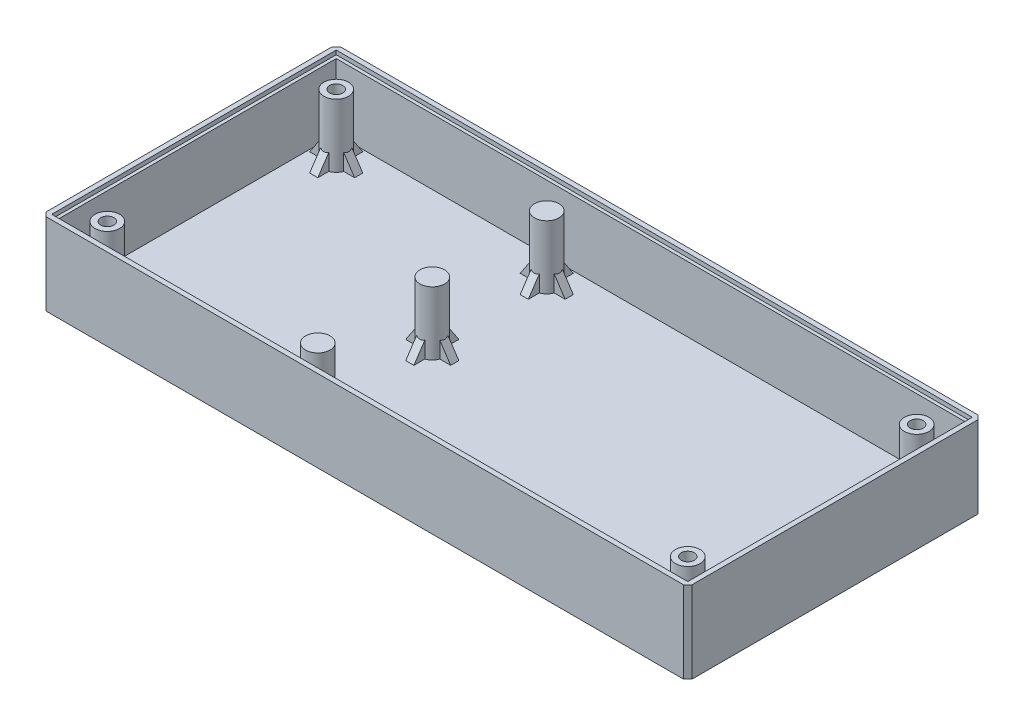
from build123d import *

# Parameters (mm, degrees)
SKETCH1_W                  = 154
SKETCH1_H                  = 68
SKETCH1_R                  = 1.6
BOSS_EXTRUDE1_DEPTH        = 3
SKETCH1_4_W                = 158
SKETCH1_4_H                = 72
SKETCH1_4_W_2              = 154
SKETCH1_4_H_2              = 68
BOSS_EXTRUDE2_DEPTH        = 19
SKETCH2_W                  = 158
SKETCH2_H                  = 72
SKETCH2_W_2                = 155.6
SKETCH2_H_2                = 69.6
BOSS_EXTRUDE3_DEPTH        = 1
SKETCH1_5_R                = 3
SKETCH1_5_R_2              = 1.6
BOSS_EXTRUDE4_DEPTH        = 18.5
BOSS_EXTRUDE5_DEPTH        = 2
SKETCH3_R                  = 1.6
CUT_EXTRUDE1_DEPTH         = 2
LPATTERN1_COUNT            = 2
LPATTERN1_PITCH            = 142
LPATTERN1_COUNT_DIR2       = 2
LPATTERN1_PITCH_DIR2       = 56
CHAMFER1_SIZE              = 1
RIB1_REACH                 = 105.619
SKETCH6_WALL_W             = 216.45009502
SKETCH6_WALL_H             = 2
CIRPATTERN3_COUNT          = 4
LPATTERN2_COPY_1_REACH     = 105.619
LPATTERN2_COPY_1_SKETCH_W  = 216.45009502
LPATTERN2_COPY_1_SKETCH_H  = 2
LPATTERN2_COPY_2_REACH     = 105.619
LPATTERN2_COPY_2_SKETCH_W  = 216.45009502
LPATTERN2_COPY_2_SKETCH_H  = 2
LPATTERN2_COPY_3_REACH     = 105.619
LPATTERN2_COPY_3_SKETCH_W  = 216.45009502
LPATTERN2_COPY_3_SKETCH_H  = 2
LPATTERN2_COPY_4_REACH     = 105.619
LPATTERN2_COPY_4_SKETCH_W  = 216.45009502
LPATTERN2_COPY_4_SKETCH_H  = 2
LPATTERN2_COPY_5_REACH     = 105.619
LPATTERN2_COPY_5_SKETCH_W  = 216.45009502
LPATTERN2_COPY_5_SKETCH_H  = 2
LPATTERN2_COPY_6_REACH     = 105.619
LPATTERN2_COPY_6_SKETCH_W  = 216.45009502
LPATTERN2_COPY_6_SKETCH_H  = 2
LPATTERN2_COPY_7_REACH     = 105.619
LPATTERN2_COPY_7_SKETCH_W  = 216.45009502
LPATTERN2_COPY_7_SKETCH_H  = 2
LPATTERN2_COPY_8_REACH     = 105.619
LPATTERN2_COPY_8_SKETCH_W  = 216.45009502
LPATTERN2_COPY_8_SKETCH_H  = 2
LPATTERN2_COPY_9_REACH     = 105.619
LPATTERN2_COPY_9_SKETCH_W  = 216.45009502
LPATTERN2_COPY_9_SKETCH_H  = 2
LPATTERN2_COPY_10_REACH    = 105.619
LPATTERN2_COPY_10_SKETCH_W = 216.45009502
LPATTERN2_COPY_10_SKETCH_H = 2
LPATTERN2_COPY_11_REACH    = 105.619
LPATTERN2_COPY_11_SKETCH_W = 216.45009502
LPATTERN2_COPY_11_SKETCH_H = 2
LPATTERN2_COPY_12_REACH    = 105.619
LPATTERN2_COPY_12_SKETCH_W = 216.45009502
LPATTERN2_COPY_12_SKETCH_H = 2
RIB2_REACH                 = 105.619
SKETCH7_WALL_W             = 216.45009502
SKETCH7_WALL_H             = 2
CIRPATTERN4_COUNT          = 4
LPATTERN8_COPY_1_REACH     = 105.619
LPATTERN8_COPY_1_SKETCH_W  = 216.45009502
LPATTERN8_COPY_1_SKETCH_H  = 2
LPATTERN8_COPY_2_REACH     = 105.619
LPATTERN8_COPY_2_SKETCH_W  = 216.45009502
LPATTERN8_COPY_2_SKETCH_H  = 2
LPATTERN8_COPY_3_REACH     = 105.619
LPATTERN8_COPY_3_SKETCH_W  = 216.45009502
LPATTERN8_COPY_3_SKETCH_H  = 2
LPATTERN8_COPY_4_REACH     = 105.619
LPATTERN8_COPY_4_SKETCH_W  = 216.45009502
LPATTERN8_COPY_4_SKETCH_H  = 2
LPATTERN8_COPY_5_REACH     = 105.619
LPATTERN8_COPY_5_SKETCH_W  = 216.45009502
LPATTERN8_COPY_5_SKETCH_H  = 2
LPATTERN8_COPY_6_REACH     = 105.619
LPATTERN8_COPY_6_SKETCH_W  = 216.45009502
LPATTERN8_COPY_6_SKETCH_H  = 2
LPATTERN8_COPY_7_REACH     = 105.619
LPATTERN8_COPY_7_SKETCH_W  = 216.45009502
LPATTERN8_COPY_7_SKETCH_H  = 2
LPATTERN8_COPY_8_REACH     = 105.619
LPATTERN8_COPY_8_SKETCH_W  = 216.45009502
LPATTERN8_COPY_8_SKETCH_H  = 2


with BuildPart() as part:
    # Sketch1 → Boss-Extrude1 (new body)
    with BuildSketch(Plane(origin=(0, 0, 0), x_dir=(1, 0, 0), z_dir=(0, 1, 0))):
        Rectangle(SKETCH1_W, SKETCH1_H)
        with Locations((-71, -28)):
            Circle(SKETCH1_R, mode=Mode.SUBTRACT)
        with Locations((71, -28)):
            Circle(SKETCH1_R, mode=Mode.SUBTRACT)
        with Locations((-71, 28)):
            Circle(SKETCH1_R, mode=Mode.SUBTRACT)
        with Locations((71, 28)):
            Circle(SKETCH1_R, mode=Mode.SUBTRACT)
    extrude(amount=BOSS_EXTRUDE1_DEPTH)

    # Sketch1<4> → Boss-Extrude2 (add)
    with BuildSketch(Plane(origin=(0, 0, 0), x_dir=(1, 0, 0), z_dir=(0, 1, 0))):
        Rectangle(SKETCH1_4_W, SKETCH1_4_H)
        Rectangle(SKETCH1_4_W_2, SKETCH1_4_H_2, mode=Mode.SUBTRACT)
    extrude(amount=BOSS_EXTRUDE2_DEPTH)

    # Sketch2 → Boss-Extrude3 (add)
    with BuildSketch(Plane(origin=(0, 19, 0), x_dir=(1, 0, 0), z_dir=(0, 1, 0))):
        Rectangle(SKETCH2_W, SKETCH2_H)
        Rectangle(SKETCH2_W_2, SKETCH2_H_2, mode=Mode.SUBTRACT)
    extrude(amount=BOSS_EXTRUDE3_DEPTH)

    # Sketch1<5> → Boss-Extrude4 (add)
    # profile 1 of 7: a face of its own
    with BuildSketch(Plane(origin=(0, 0, 0), x_dir=(1, 0, 0), z_dir=(0, 1, 0))):
        with Locations((-71, 28)):
            Circle(SKETCH1_5_R)
        with Locations((-71, 28)):
            Circle(SKETCH1_5_R_2, mode=Mode.SUBTRACT)
    # profile 2 of 7: a face of its own
    with BuildSketch(Plane(origin=(0, 0, 0), x_dir=(1, 0, 0), z_dir=(0, 1, 0))):
        with Locations((71, 28)):
            Circle(SKETCH1_5_R)
        with Locations((71, 28)):
            Circle(SKETCH1_5_R_2, mode=Mode.SUBTRACT)
    # profile 3 of 7: a face of its own
    with BuildSketch(Plane(origin=(0, 0, 0), x_dir=(1, 0, 0), z_dir=(0, 1, 0))):
        with Locations((71, -28)):
            Circle(SKETCH1_5_R)
        with Locations((71, -28)):
            Circle(SKETCH1_5_R_2, mode=Mode.SUBTRACT)
    # profile 4 of 7: a face of its own
    with BuildSketch(Plane(origin=(0, 0, 0), x_dir=(1, 0, 0), z_dir=(0, 1, 0))):
        with Locations((-71, -28)):
            Circle(SKETCH1_5_R)
        with Locations((-71, -28)):
            Circle(SKETCH1_5_R_2, mode=Mode.SUBTRACT)
    # profile 5 of 7: a face of its own
    with BuildSketch(Plane(origin=(0, 0, 0), x_dir=(1, 0, 0), z_dir=(0, 1, 0))):
        with Locations((-19.5, 28)):
            Circle(SKETCH1_5_R)
    # profile 6 of 7: a face of its own
    with BuildSketch(Plane(origin=(0, 0, 0), x_dir=(1, 0, 0), z_dir=(0, 1, 0))):
        with Locations((-19.5, -28)):
            Circle(SKETCH1_5_R)
    # profile 7 of 7: a face of its own
    with BuildSketch(Plane(origin=(0, 0, 0), x_dir=(1, 0, 0), z_dir=(0, 1, 0))):
        with Locations((-19.5, 0)):
            Circle(SKETCH1_5_R)
    extrude(amount=BOSS_EXTRUDE4_DEPTH)

    # Sketch3<3> → Boss-Extrude5 (add)
    with BuildSketch(Plane.XZ):
        Polygon((-68.834936491, 24.25), (-66.669872981, 28), (-68.834936491, 31.75), (-73.165063509, 31.75), (-75.330127019, 28), (-73.165063509, 24.25), align=None)
        Polygon((-69.41228676, 25.25), (-67.824573519, 28), (-69.41228676, 30.75), (-72.58771324, 30.75), (-74.175426481, 28), (-72.58771324, 25.25), align=None, mode=Mode.SUBTRACT)
    boss_extrude5 = extrude(amount=-BOSS_EXTRUDE5_DEPTH)

    # Sketch3 → Cut-Extrude1 (cut)
    with BuildSketch(Plane.XZ):
        Polygon((-72.58771324, 25.25), (-69.41228676, 25.25), (-67.824573519, 28), (-69.41228676, 30.75), (-72.58771324, 30.75), (-74.175426481, 28), align=None)
        with Locations((-71, 28)):
            Circle(SKETCH3_R, mode=Mode.SUBTRACT)
    cut_extrude1 = extrude(amount=-CUT_EXTRUDE1_DEPTH, mode=Mode.SUBTRACT)

    # LPattern1: Boss-Extrude5, Cut-Extrude1 2 × 2
    with Locations(*[(i * LPATTERN1_PITCH, 0, -j * LPATTERN1_PITCH_DIR2) for i in range(LPATTERN1_COUNT) for j in range(LPATTERN1_COUNT_DIR2) if (i, j) != (0, 0)]):
        add(boss_extrude5)
        add(cut_extrude1, mode=Mode.SUBTRACT)

    # Chamfer1
    chamfer1_edges = [part.edges().sort_by_distance(p)[0] for p in [
        (-79, 10, 36),
        (-79, 10, -36),
        (79, 10, 36),
        (79, 10, -36),
    ]]
    chamfer(chamfer1_edges, length=CHAMFER1_SIZE)

    # Sketch6 wall → Rib1 (add, up to next)
    with BuildSketch(Plane(origin=(67.5, 6, -28), x_dir=(0.554700196225, 0.832050294338, 0), z_dir=(-0.832050294338, 0.554700196225, 0)), mode=Mode.PRIVATE) as rib1_sk1:
        Rectangle(SKETCH6_WALL_W, SKETCH6_WALL_H)
    rib1_tool1 = extrude(rib1_sk1.sketch, amount=-RIB1_REACH, mode=Mode.PRIVATE) - part.part
    rib1 = rib1_tool1.solids().sort_by_distance((67.5, 6, -28))[0]
    add(rib1)

    # CirPattern3: Rib1 ×4 about axis
    cirpattern3_axis = Axis((71, 3, -28), (0, 1, 0))
    for i in range(1, CIRPATTERN3_COUNT):
        add(rib1.rotate(cirpattern3_axis, i * 360 / CIRPATTERN3_COUNT))

    # LPattern2 copy 1 sketch → LPattern2 copy 1 (add, up to next)
    with BuildSketch(Plane(origin=(71, 6, 31.5), x_dir=(0, 0.832050294338, -0.554700196225), z_dir=(0, 0.554700196225, 0.832050294338)), mode=Mode.PRIVATE) as lpattern2_copy_1_sk1:
        Rectangle(LPATTERN2_COPY_1_SKETCH_W, LPATTERN2_COPY_1_SKETCH_H)
    lpattern2_copy_1_tool1 = extrude(lpattern2_copy_1_sk1.sketch, amount=-LPATTERN2_COPY_1_REACH, mode=Mode.PRIVATE) - part.part
    add(lpattern2_copy_1_tool1.solids().sort_by_distance((71, 6, 31.5))[0])

    # LPattern2 copy 2 sketch → LPattern2 copy 2 (add, up to next)
    with BuildSketch(Plane(origin=(-71, 6, -24.5), x_dir=(0, 0.832050294338, -0.554700196225), z_dir=(0, 0.554700196225, 0.832050294338)), mode=Mode.PRIVATE) as lpattern2_copy_2_sk1:
        Rectangle(LPATTERN2_COPY_2_SKETCH_W, LPATTERN2_COPY_2_SKETCH_H)
    lpattern2_copy_2_tool1 = extrude(lpattern2_copy_2_sk1.sketch, amount=-LPATTERN2_COPY_2_REACH, mode=Mode.PRIVATE) - part.part
    add(lpattern2_copy_2_tool1.solids().sort_by_distance((-71, 6, -24.5))[0])

    # LPattern2 copy 3 sketch → LPattern2 copy 3 (add, up to next)
    with BuildSketch(Plane(origin=(-71, 6, 31.5), x_dir=(0, 0.832050294338, -0.554700196225), z_dir=(0, 0.554700196225, 0.832050294338)), mode=Mode.PRIVATE) as lpattern2_copy_3_sk1:
        Rectangle(LPATTERN2_COPY_3_SKETCH_W, LPATTERN2_COPY_3_SKETCH_H)
    lpattern2_copy_3_tool1 = extrude(lpattern2_copy_3_sk1.sketch, amount=-LPATTERN2_COPY_3_REACH, mode=Mode.PRIVATE) - part.part
    add(lpattern2_copy_3_tool1.solids().sort_by_distance((-71, 6, 31.5))[0])

    # LPattern2 copy 4 sketch → LPattern2 copy 4 (add, up to next)
    with BuildSketch(Plane(origin=(74.5, 6, 28), x_dir=(-0.554700196225, 0.832050294338, 0), z_dir=(0.832050294338, 0.554700196225, 0)), mode=Mode.PRIVATE) as lpattern2_copy_4_sk1:
        Rectangle(LPATTERN2_COPY_4_SKETCH_W, LPATTERN2_COPY_4_SKETCH_H)
    lpattern2_copy_4_tool1 = extrude(lpattern2_copy_4_sk1.sketch, amount=-LPATTERN2_COPY_4_REACH, mode=Mode.PRIVATE) - part.part
    add(lpattern2_copy_4_tool1.solids().sort_by_distance((74.5, 6, 28))[0])

    # LPattern2 copy 5 sketch → LPattern2 copy 5 (add, up to next)
    with BuildSketch(Plane(origin=(-67.5, 6, -28), x_dir=(-0.554700196225, 0.832050294338, 0), z_dir=(0.832050294338, 0.554700196225, 0)), mode=Mode.PRIVATE) as lpattern2_copy_5_sk1:
        Rectangle(LPATTERN2_COPY_5_SKETCH_W, LPATTERN2_COPY_5_SKETCH_H)
    lpattern2_copy_5_tool1 = extrude(lpattern2_copy_5_sk1.sketch, amount=-LPATTERN2_COPY_5_REACH, mode=Mode.PRIVATE) - part.part
    add(lpattern2_copy_5_tool1.solids().sort_by_distance((-67.5, 6, -28))[0])

    # LPattern2 copy 6 sketch → LPattern2 copy 6 (add, up to next)
    with BuildSketch(Plane(origin=(-67.5, 6, 28), x_dir=(-0.554700196225, 0.832050294338, 0), z_dir=(0.832050294338, 0.554700196225, 0)), mode=Mode.PRIVATE) as lpattern2_copy_6_sk1:
        Rectangle(LPATTERN2_COPY_6_SKETCH_W, LPATTERN2_COPY_6_SKETCH_H)
    lpattern2_copy_6_tool1 = extrude(lpattern2_copy_6_sk1.sketch, amount=-LPATTERN2_COPY_6_REACH, mode=Mode.PRIVATE) - part.part
    add(lpattern2_copy_6_tool1.solids().sort_by_distance((-67.5, 6, 28))[0])

    # LPattern2 copy 7 sketch → LPattern2 copy 7 (add, up to next)
    with BuildSketch(Plane(origin=(71, 6, 24.5), x_dir=(0, 0.832050294338, 0.554700196225), z_dir=(0, 0.554700196225, -0.832050294338)), mode=Mode.PRIVATE) as lpattern2_copy_7_sk1:
        Rectangle(LPATTERN2_COPY_7_SKETCH_W, LPATTERN2_COPY_7_SKETCH_H)
    lpattern2_copy_7_tool1 = extrude(lpattern2_copy_7_sk1.sketch, amount=-LPATTERN2_COPY_7_REACH, mode=Mode.PRIVATE) - part.part
    add(lpattern2_copy_7_tool1.solids().sort_by_distance((71, 6, 24.5))[0])

    # LPattern2 copy 8 sketch → LPattern2 copy 8 (add, up to next)
    with BuildSketch(Plane(origin=(-71, 6, -31.5), x_dir=(0, 0.832050294338, 0.554700196225), z_dir=(0, 0.554700196225, -0.832050294338)), mode=Mode.PRIVATE) as lpattern2_copy_8_sk1:
        Rectangle(LPATTERN2_COPY_8_SKETCH_W, LPATTERN2_COPY_8_SKETCH_H)
    lpattern2_copy_8_tool1 = extrude(lpattern2_copy_8_sk1.sketch, amount=-LPATTERN2_COPY_8_REACH, mode=Mode.PRIVATE) - part.part
    add(lpattern2_copy_8_tool1.solids().sort_by_distance((-71, 6, -31.5))[0])

    # LPattern2 copy 9 sketch → LPattern2 copy 9 (add, up to next)
    with BuildSketch(Plane(origin=(-71, 6, 24.5), x_dir=(0, 0.832050294338, 0.554700196225), z_dir=(0, 0.554700196225, -0.832050294338)), mode=Mode.PRIVATE) as lpattern2_copy_9_sk1:
        Rectangle(LPATTERN2_COPY_9_SKETCH_W, LPATTERN2_COPY_9_SKETCH_H)
    lpattern2_copy_9_tool1 = extrude(lpattern2_copy_9_sk1.sketch, amount=-LPATTERN2_COPY_9_REACH, mode=Mode.PRIVATE) - part.part
    add(lpattern2_copy_9_tool1.solids().sort_by_distance((-71, 6, 24.5))[0])

    # LPattern2 copy 10 sketch → LPattern2 copy 10 (add, up to next)
    with BuildSketch(Plane(origin=(67.5, 6, 28), x_dir=(0.554700196225, 0.832050294338, 0), z_dir=(-0.832050294338, 0.554700196225, 0)), mode=Mode.PRIVATE) as lpattern2_copy_10_sk1:
        Rectangle(LPATTERN2_COPY_10_SKETCH_W, LPATTERN2_COPY_10_SKETCH_H)
    lpattern2_copy_10_tool1 = extrude(lpattern2_copy_10_sk1.sketch, amount=-LPATTERN2_COPY_10_REACH, mode=Mode.PRIVATE) - part.part
    add(lpattern2_copy_10_tool1.solids().sort_by_distance((67.5, 6, 28))[0])

    # LPattern2 copy 11 sketch → LPattern2 copy 11 (add, up to next)
    with BuildSketch(Plane(origin=(-74.5, 6, -28), x_dir=(0.554700196225, 0.832050294338, 0), z_dir=(-0.832050294338, 0.554700196225, 0)), mode=Mode.PRIVATE) as lpattern2_copy_11_sk1:
        Rectangle(LPATTERN2_COPY_11_SKETCH_W, LPATTERN2_COPY_11_SKETCH_H)
    lpattern2_copy_11_tool1 = extrude(lpattern2_copy_11_sk1.sketch, amount=-LPATTERN2_COPY_11_REACH, mode=Mode.PRIVATE) - part.part
    add(lpattern2_copy_11_tool1.solids().sort_by_distance((-74.5, 6, -28))[0])

    # LPattern2 copy 12 sketch → LPattern2 copy 12 (add, up to next)
    with BuildSketch(Plane(origin=(-74.5, 6, 28), x_dir=(0.554700196225, 0.832050294338, 0), z_dir=(-0.832050294338, 0.554700196225, 0)), mode=Mode.PRIVATE) as lpattern2_copy_12_sk1:
        Rectangle(LPATTERN2_COPY_12_SKETCH_W, LPATTERN2_COPY_12_SKETCH_H)
    lpattern2_copy_12_tool1 = extrude(lpattern2_copy_12_sk1.sketch, amount=-LPATTERN2_COPY_12_REACH, mode=Mode.PRIVATE) - part.part
    add(lpattern2_copy_12_tool1.solids().sort_by_distance((-74.5, 6, 28))[0])

    # Sketch7 wall → Rib2 (add, up to next)
    with BuildSketch(Plane(origin=(-23, 6, -28), x_dir=(0.554700196225, 0.832050294338, 0), z_dir=(-0.832050294338, 0.554700196225, 0)), mode=Mode.PRIVATE) as rib2_sk1:
        Rectangle(SKETCH7_WALL_W, SKETCH7_WALL_H)
    rib2_tool1 = extrude(rib2_sk1.sketch, amount=-RIB2_REACH, mode=Mode.PRIVATE) - part.part
    rib2 = rib2_tool1.solids().sort_by_distance((-23, 6, -28))[0]
    add(rib2)

    # CirPattern4: Rib2 ×4 about axis
    cirpattern4_axis = Axis((-19.5, 18.5, -28), (0, 1, 0))
    for i in range(1, CIRPATTERN4_COUNT):
        add(rib2.rotate(cirpattern4_axis, i * 360 / CIRPATTERN4_COUNT))

    # LPattern8 copy 1 sketch → LPattern8 copy 1 (add, up to next)
    with BuildSketch(Plane(origin=(-19.5, 6, 3.5), x_dir=(0, 0.832050294338, -0.554700196225), z_dir=(0, 0.554700196225, 0.832050294338)), mode=Mode.PRIVATE) as lpattern8_copy_1_sk1:
        Rectangle(LPATTERN8_COPY_1_SKETCH_W, LPATTERN8_COPY_1_SKETCH_H)
    lpattern8_copy_1_tool1 = extrude(lpattern8_copy_1_sk1.sketch, amount=-LPATTERN8_COPY_1_REACH, mode=Mode.PRIVATE) - part.part
    add(lpattern8_copy_1_tool1.solids().sort_by_distance((-19.5, 6, 3.5))[0])

    # LPattern8 copy 2 sketch → LPattern8 copy 2 (add, up to next)
    with BuildSketch(Plane(origin=(-19.5, 6, 31.5), x_dir=(0, 0.832050294338, -0.554700196225), z_dir=(0, 0.554700196225, 0.832050294338)), mode=Mode.PRIVATE) as lpattern8_copy_2_sk1:
        Rectangle(LPATTERN8_COPY_2_SKETCH_W, LPATTERN8_COPY_2_SKETCH_H)
    lpattern8_copy_2_tool1 = extrude(lpattern8_copy_2_sk1.sketch, amount=-LPATTERN8_COPY_2_REACH, mode=Mode.PRIVATE) - part.part
    add(lpattern8_copy_2_tool1.solids().sort_by_distance((-19.5, 6, 31.5))[0])

    # LPattern8 copy 3 sketch → LPattern8 copy 3 (add, up to next)
    with BuildSketch(Plane(origin=(-16, 6, 0), x_dir=(-0.554700196225, 0.832050294338, 0), z_dir=(0.832050294338, 0.554700196225, 0)), mode=Mode.PRIVATE) as lpattern8_copy_3_sk1:
        Rectangle(LPATTERN8_COPY_3_SKETCH_W, LPATTERN8_COPY_3_SKETCH_H)
    lpattern8_copy_3_tool1 = extrude(lpattern8_copy_3_sk1.sketch, amount=-LPATTERN8_COPY_3_REACH, mode=Mode.PRIVATE) - part.part
    add(lpattern8_copy_3_tool1.solids().sort_by_distance((-16, 6, 0))[0])

    # LPattern8 copy 4 sketch → LPattern8 copy 4 (add, up to next)
    with BuildSketch(Plane(origin=(-16, 6, 28), x_dir=(-0.554700196225, 0.832050294338, 0), z_dir=(0.832050294338, 0.554700196225, 0)), mode=Mode.PRIVATE) as lpattern8_copy_4_sk1:
        Rectangle(LPATTERN8_COPY_4_SKETCH_W, LPATTERN8_COPY_4_SKETCH_H)
    lpattern8_copy_4_tool1 = extrude(lpattern8_copy_4_sk1.sketch, amount=-LPATTERN8_COPY_4_REACH, mode=Mode.PRIVATE) - part.part
    add(lpattern8_copy_4_tool1.solids().sort_by_distance((-16, 6, 28))[0])

    # LPattern8 copy 5 sketch → LPattern8 copy 5 (add, up to next)
    with BuildSketch(Plane(origin=(-19.5, 6, -3.5), x_dir=(0, 0.832050294338, 0.554700196225), z_dir=(0, 0.554700196225, -0.832050294338)), mode=Mode.PRIVATE) as lpattern8_copy_5_sk1:
        Rectangle(LPATTERN8_COPY_5_SKETCH_W, LPATTERN8_COPY_5_SKETCH_H)
    lpattern8_copy_5_tool1 = extrude(lpattern8_copy_5_sk1.sketch, amount=-LPATTERN8_COPY_5_REACH, mode=Mode.PRIVATE) - part.part
    add(lpattern8_copy_5_tool1.solids().sort_by_distance((-19.5, 6, -3.5))[0])

    # LPattern8 copy 6 sketch → LPattern8 copy 6 (add, up to next)
    with BuildSketch(Plane(origin=(-19.5, 6, 24.5), x_dir=(0, 0.832050294338, 0.554700196225), z_dir=(0, 0.554700196225, -0.832050294338)), mode=Mode.PRIVATE) as lpattern8_copy_6_sk1:
        Rectangle(LPATTERN8_COPY_6_SKETCH_W, LPATTERN8_COPY_6_SKETCH_H)
    lpattern8_copy_6_tool1 = extrude(lpattern8_copy_6_sk1.sketch, amount=-LPATTERN8_COPY_6_REACH, mode=Mode.PRIVATE) - part.part
    add(lpattern8_copy_6_tool1.solids().sort_by_distance((-19.5, 6, 24.5))[0])

    # LPattern8 copy 7 sketch → LPattern8 copy 7 (add, up to next)
    with BuildSketch(Plane(origin=(-23, 6, 0), x_dir=(0.554700196225, 0.832050294338, 0), z_dir=(-0.832050294338, 0.554700196225, 0)), mode=Mode.PRIVATE) as lpattern8_copy_7_sk1:
        Rectangle(LPATTERN8_COPY_7_SKETCH_W, LPATTERN8_COPY_7_SKETCH_H)
    lpattern8_copy_7_tool1 = extrude(lpattern8_copy_7_sk1.sketch, amount=-LPATTERN8_COPY_7_REACH, mode=Mode.PRIVATE) - part.part
    add(lpattern8_copy_7_tool1.solids().sort_by_distance((-23, 6, 0))[0])

    # LPattern8 copy 8 sketch → LPattern8 copy 8 (add, up to next)
    with BuildSketch(Plane(origin=(-23, 6, 28), x_dir=(0.554700196225, 0.832050294338, 0), z_dir=(-0.832050294338, 0.554700196225, 0)), mode=Mode.PRIVATE) as lpattern8_copy_8_sk1:
        Rectangle(LPATTERN8_COPY_8_SKETCH_W, LPATTERN8_COPY_8_SKETCH_H)
    lpattern8_copy_8_tool1 = extrude(lpattern8_copy_8_sk1.sketch, amount=-LPATTERN8_COPY_8_REACH, mode=Mode.PRIVATE) - part.part
    add(lpattern8_copy_8_tool1.solids().sort_by_distance((-23, 6, 28))[0])


solid = part.part
